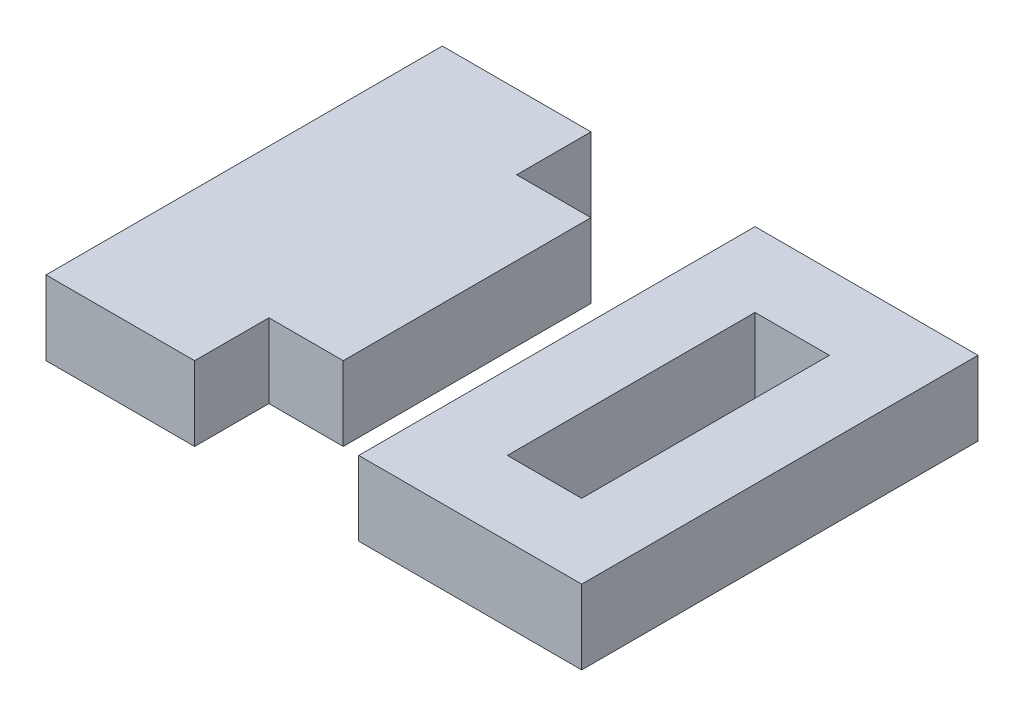
from build123d import *

# Parameters (mm, degrees)
SKETCH1_W           = 12
SKETCH1_H           = 32
SKETCH1_W_2         = 6
SKETCH1_H_2         = 20
SKETCH1_W_3         = 18
BOSS_EXTRUDE1_DEPTH = 6


with BuildPart() as part:
    # Sketch1 → Boss-Extrude1 (new body)
    # profile 1 of 3: a face of its own
    with BuildSketch(Plane(origin=(0, 0, 0), x_dir=(1, 0, 0), z_dir=(0, 1, 0))):
        with Locations((-37.25, 16)):
            Rectangle(SKETCH1_W, SKETCH1_H)
    # profile 2 of 3: a face of its own
    with BuildSketch(Plane(origin=(0, 0, 0), x_dir=(1, 0, 0), z_dir=(0, 1, 0))):
        with Locations((-28.25, 16)):
            Rectangle(SKETCH1_W_2, SKETCH1_H_2)
    # profile 3 of 3: a face of its own
    with BuildSketch(Plane(origin=(0, 0, 0), x_dir=(1, 0, 0), z_dir=(0, 1, 0))):
        with Locations((-9, 16)):
            Rectangle(SKETCH1_W_3, SKETCH1_H)
        with Locations((-9, 16)):
            Rectangle(SKETCH1_W_2, SKETCH1_H_2, mode=Mode.SUBTRACT)
    extrude(amount=BOSS_EXTRUDE1_DEPTH)


solid = part.part
